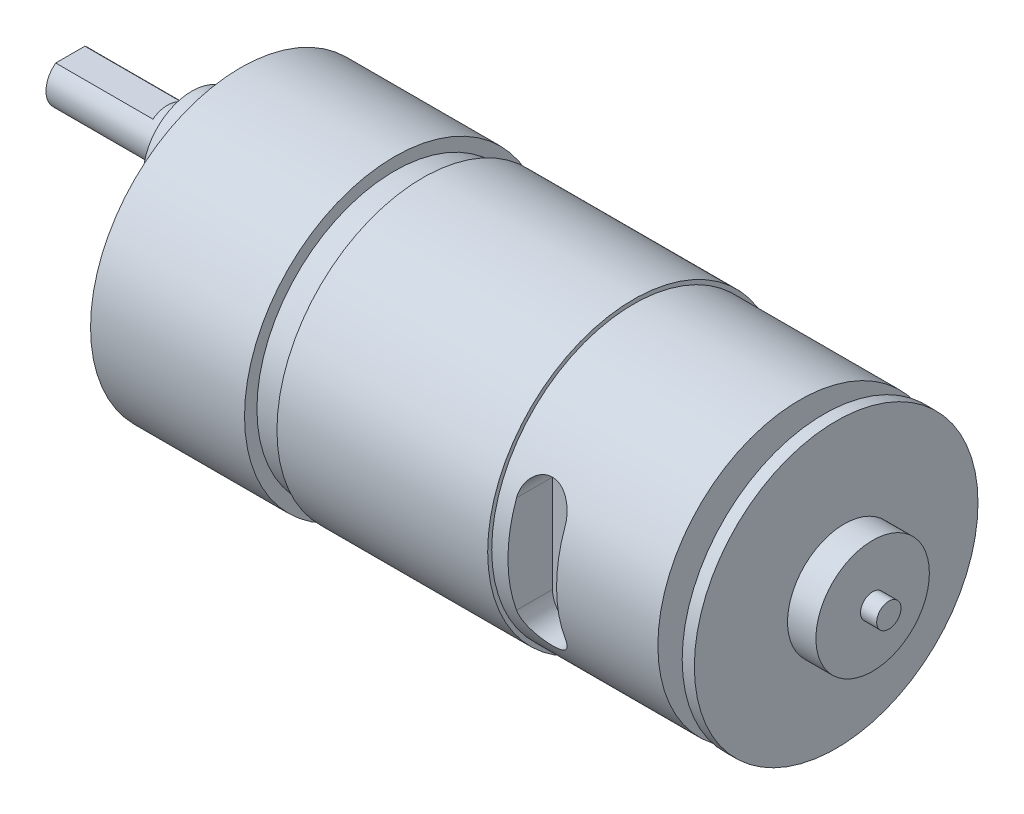
from build123d import *

# Parameters (mm, degrees)
CUT_EXTRUDE_1_DEPTH      = 1
SKETCH_3_R               = 6
EXTRUDE_1_DEPTH          = 6
SKETCH_4_R               = 3
EXTRUDE_2_DEPTH          = 15
SKETCH_5_W               = 8.431927353
SKETCH_5_H               = 1.818650998
CUT_EXTRUDE_2_DEPTH      = 12
SKETCH_6_R               = 1.5
CUT_EXTRUDE_3_DEPTH      = 5
SKETCH_8_R               = 2
CUT_EXTRUDE_4_DEPTH      = 5
CUT_EXTRUDE_5_DEPTH      = 74.793631162
CUT_EXTRUDE_5_DEPTH_BACK = 74.793631162
EXTRUDE_3_DEPTH          = 12
EXTRUDE_3_DEPTH_BACK     = 12
SKETCH_11_R              = 4.5
EXTRUDE_4_DEPTH          = 3
EXTRUDE_START            = 1.5
SKETCH_12_R              = 17.5
EXTRUDE_5_DEPTH          = 1.5
SKETCH_13_W              = 0.2
SKETCH_13_H              = 4
EXTRUDE_6_DEPTH          = 5
SKETCH_14_R              = 1.5
EXTRUDE_7_DEPTH          = 1
SKETCH_15_R              = 7
EXTRUDE_8_DEPTH          = 3.5
SKETCH_16_R              = 1.5
EXTRUDE_9_DEPTH          = 2


with BuildPart() as part:
    # 草图1 → 旋转1 (revolve)
    with BuildSketch(Plane(origin=(0, 0, 0), x_dir=(1, 0, 0), z_dir=(0, 1, 0))):
        Polygon((0, 0), (0, 18.5), (19, 18.5), (19, 16.970676932), (22.5, 16.970676932), (22.5, 18), (48.5, 18), (48.5, 17.5), (69, 17.5), (69, 0), align=None)
    revolve(axis=Axis((-22.922421057, 0, 0), (1, 0, 0)))

    # 草图2 → 切除-拉伸1 (cut)
    with BuildSketch(Plane.ZY):
        with BuildLine():
            ThreePointArc((-8.94427191, 8), (0, -12), (8.94427191, 8))
            ThreePointArc((8.94427191, 8), (0, -2), (-8.94427191, 8))
        make_face()
    extrude(amount=-CUT_EXTRUDE_1_DEPTH, mode=Mode.SUBTRACT)

    # 草图3 → 凸台-拉伸1 (add)
    with BuildSketch(Plane.ZY):
        with Locations((0, 7)):
            Circle(SKETCH_3_R)
    extrude(amount=EXTRUDE_1_DEPTH)

    # 草图4 → 凸台-拉伸2 (add)
    with BuildSketch(Plane.ZY.offset(6)):
        with Locations((0, 7)):
            Circle(SKETCH_4_R)
    extrude(amount=EXTRUDE_2_DEPTH)

    # 草图5 → 切除-拉伸2 (cut)
    with BuildSketch(Plane.ZY.offset(21)):
        with Locations((0.29013852, 10.309325499)):
            Rectangle(SKETCH_5_W, SKETCH_5_H)
    extrude(amount=-CUT_EXTRUDE_2_DEPTH, mode=Mode.SUBTRACT)

    # 草图6 → 切除-拉伸3 (cut)
    with BuildSketch(Plane.ZY):
        with Locations((-15.5, 0)):
            Circle(SKETCH_6_R)
        with Locations((-7.75, 13.423393759)):
            Circle(SKETCH_6_R)
        with Locations((7.75, 13.423393759)):
            Circle(SKETCH_6_R)
        with Locations((15.5, 0)):
            Circle(SKETCH_6_R)
        with Locations((7.75, -13.423393759)):
            Circle(SKETCH_6_R)
        with Locations((-7.75, -13.423393759)):
            Circle(SKETCH_6_R)
        with Locations((-13.423393759, 7.75)):
            Circle(SKETCH_6_R)
    extrude(amount=-CUT_EXTRUDE_3_DEPTH, mode=Mode.SUBTRACT)

    # 草图8 → 切除-拉伸4 (cut)
    with BuildSketch(Plane.ZY):
        with Locations((-13.423393759, 7.75)):
            Circle(SKETCH_8_R)
        with Locations((13.423393759, 7.75)):
            Circle(SKETCH_8_R)
        with Locations((0, -15.5)):
            Circle(SKETCH_8_R)
    extrude(amount=-CUT_EXTRUDE_4_DEPTH, mode=Mode.SUBTRACT)

    # 草图9 → 切除-拉伸5 (cut, two sides: drawn at the far end of the back side and taken through both)
    with BuildSketch(Plane.XY.offset(-CUT_EXTRUDE_5_DEPTH_BACK)):
        with BuildLine():
            Line((50.5, -6), (50.5, 6))
            ThreePointArc((50.5, 6), (53.5, 9), (56.5, 6))
            Line((56.5, 6), (56.5, -6))
            ThreePointArc((56.5, -6), (53.5, -9), (50.5, -6))
        make_face()
    extrude(amount=CUT_EXTRUDE_5_DEPTH + CUT_EXTRUDE_5_DEPTH_BACK, mode=Mode.SUBTRACT)

    # 草图10 → 凸台-拉伸3 (add, two sides: drawn at the far end of the back side and taken through both)
    with BuildSketch(Plane.XY.offset(-EXTRUDE_3_DEPTH_BACK)):
        with BuildLine():
            Line((50.5, 6), (50.5, -6))
            ThreePointArc((50.5, -6), (53.5, -9), (56.5, -6))
            Line((56.5, -6), (56.5, 6))
            ThreePointArc((56.5, 6), (53.5, 9), (50.5, 6))
        make_face()
    extrude(amount=EXTRUDE_3_DEPTH + EXTRUDE_3_DEPTH_BACK)

    # 草图11 → 凸台-拉伸4 (add)
    with BuildSketch(Plane(origin=(69, 0, 0), x_dir=(0, 0, -1), z_dir=(1, 0, 0))):
        Circle(SKETCH_11_R)
    extrude(amount=EXTRUDE_4_DEPTH)

    # 草图12 → 凸台-拉伸5 (add)
    with BuildSketch(Plane(origin=(72, 0, 0), x_dir=(0, 0, -1), z_dir=(1, 0, 0)).offset(EXTRUDE_START)):
        Circle(SKETCH_12_R)
    extrude(amount=-EXTRUDE_5_DEPTH)

    # 草图13 → 凸台-拉伸6 (add)
    with BuildSketch(Plane(origin=(73.5, 0, 0), x_dir=(0, 0, -1), z_dir=(1, 0, 0))):
        with Locations((-12.869137114, 0)):
            Rectangle(SKETCH_13_W, SKETCH_13_H)
        with Locations((12.869137114, 0)):
            Rectangle(SKETCH_13_W, SKETCH_13_H)
    extrude(amount=-EXTRUDE_6_DEPTH)

    # 草图14 → 凸台-拉伸7 (add)
    with BuildSketch(Plane(origin=(73.5, 0, 0), x_dir=(0, 0, -1), z_dir=(1, 0, 0))):
        Circle(SKETCH_14_R)
    extrude(amount=EXTRUDE_7_DEPTH)

    # 草图15 → 凸台-拉伸8 (add)
    with BuildSketch(Plane(origin=(74.5, 0, 0), x_dir=(0, 0, -1), z_dir=(1, 0, 0))):
        Circle(SKETCH_15_R)
    extrude(amount=EXTRUDE_8_DEPTH)

    # 草图16 → 凸台-拉伸9 (add)
    with BuildSketch(Plane(origin=(78, 0, 0), x_dir=(0, 0, -1), z_dir=(1, 0, 0))):
        Circle(SKETCH_16_R)
    extrude(amount=EXTRUDE_9_DEPTH)


solid = part.part
